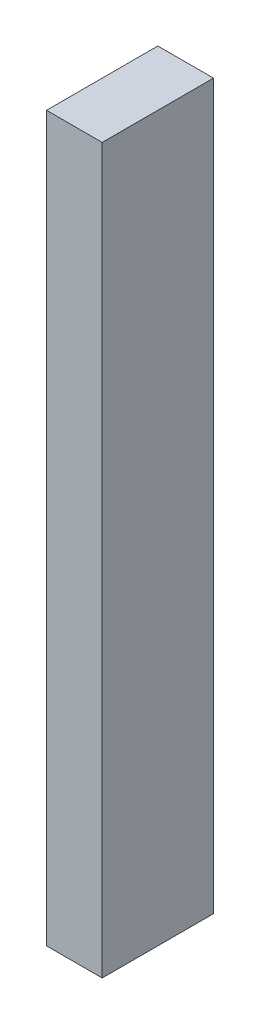
from build123d import *

# Parameters (mm, degrees)
SKETCH1_W           = 40
SKETCH1_H           = 80
BOSS_EXTRUDE1_DEPTH = 520


with BuildPart() as part:
    # Sketch1 → Boss-Extrude1 (new body)
    with BuildSketch(Plane(origin=(0, 0, 0), x_dir=(1, 0, 0), z_dir=(0, 1, 0))):
        Rectangle(SKETCH1_W, SKETCH1_H)
    extrude(amount=BOSS_EXTRUDE1_DEPTH)


solid = part.part
